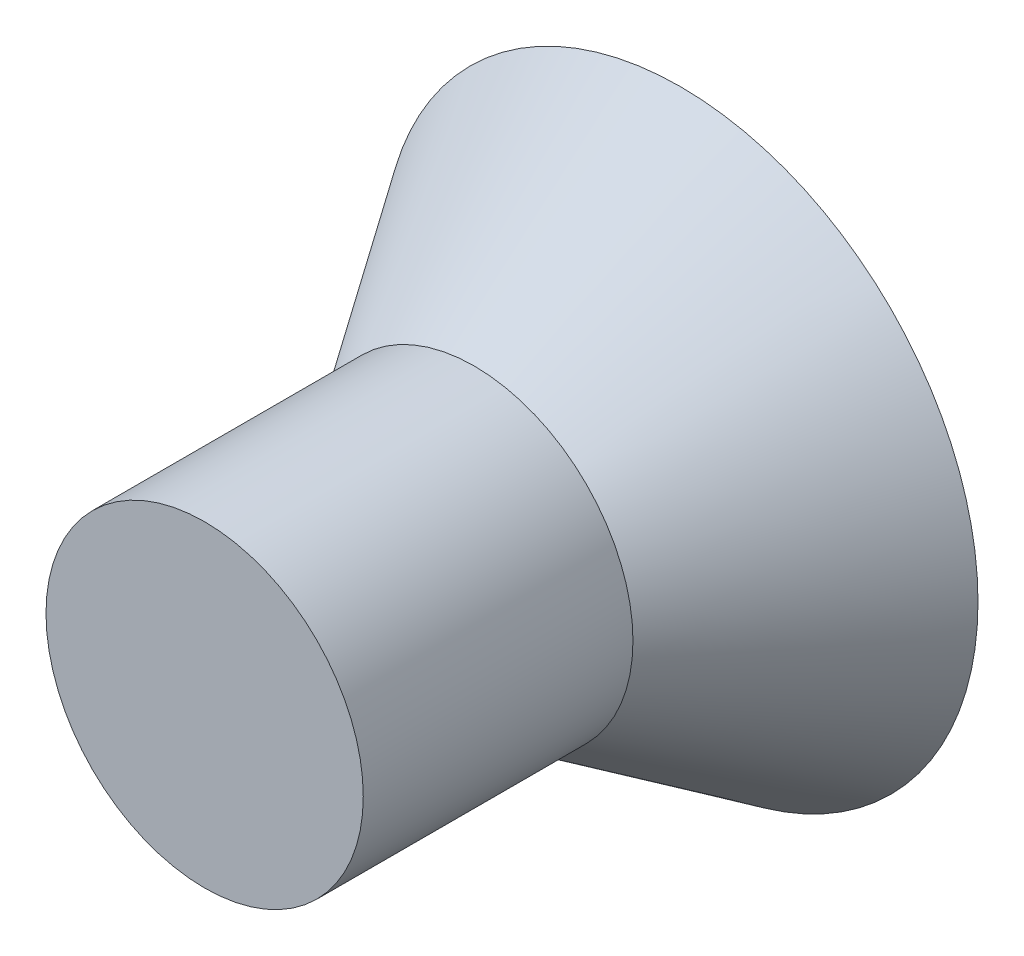
from build123d import *

# Parameters (mm, degrees)
SKETCH_1_R      = 2
EXTRUDE_1_DEPTH = 6


with BuildPart() as part:
    # 草图1 → 凸台-拉伸1 (new body)
    with BuildSketch(Plane.XY):
        Circle(SKETCH_1_R)
    extrude(amount=EXTRUDE_1_DEPTH)

    # 草图2 → 旋转1 (revolve)
    with BuildSketch(Plane(origin=(0, 0, 0), x_dir=(1, 0, 0), z_dir=(0, 1, 0)), mode=Mode.PRIVATE) as revolve_1_sk:
        Polygon((0, 0), (3.75, 0), (0, -5.571428571), align=None)
    revolve(revolve_1_sk.sketch.rotate(Axis((0, 0, 5.571428571), (0, 0, -1)), 180), axis=Axis((0, 0, 5.571428571), (0, 0, -1)))


solid = part.part
